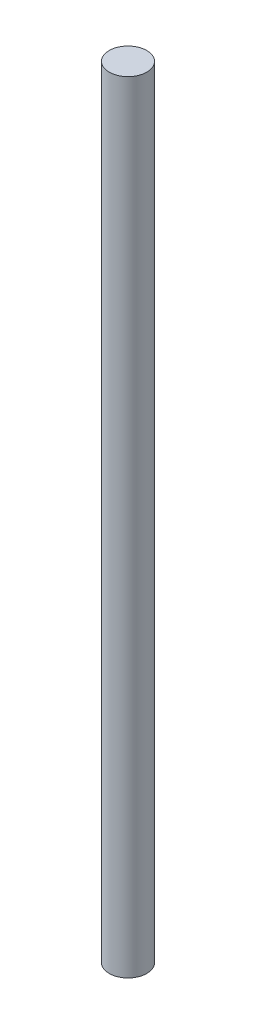
from build123d import *

# Parameters (mm, degrees)
SKETCH1_R           = 1.9
BOSS_EXTRUDE1_DEPTH = 79


with BuildPart() as part:
    # Sketch1 → Boss-Extrude1 (new body)
    with BuildSketch(Plane(origin=(0, 0, 0), x_dir=(1, 0, 0), z_dir=(0, 1, 0))):
        with Locations(Location((0, 0, 0), (0, 0, 270))):
            Circle(SKETCH1_R)
    extrude(amount=BOSS_EXTRUDE1_DEPTH)


solid = part.part
